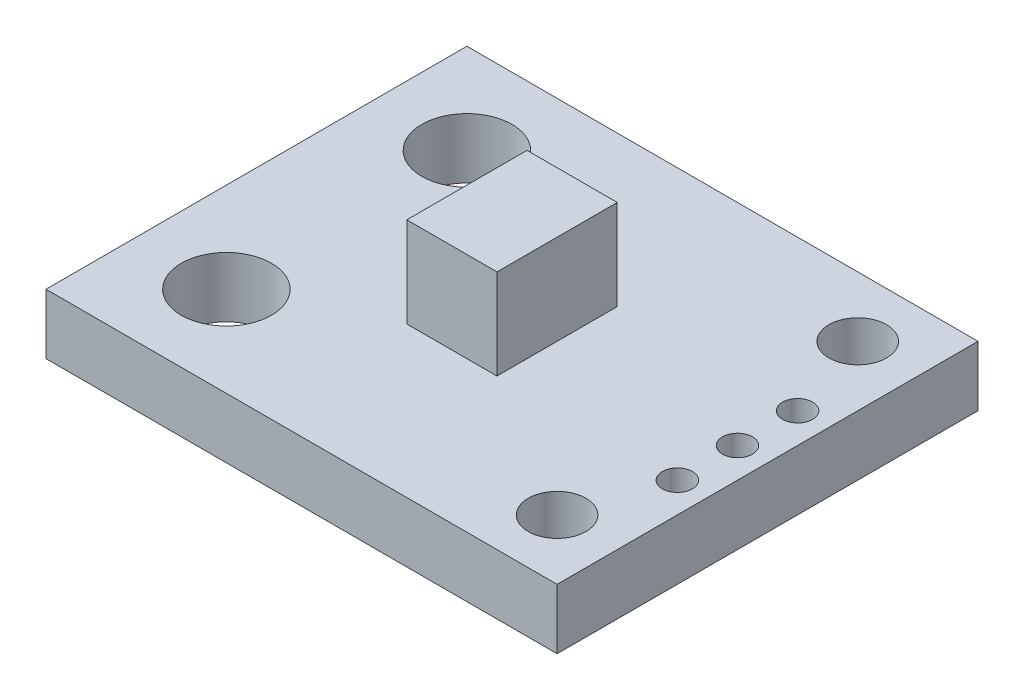
from build123d import *

# Parameters (mm, degrees)
SKETCH1_W                 = 21.59
SKETCH1_H                 = 17.78
BOSS_EXTRUDE1_DEPTH       = 2.54
SKETCH2_R                 = 1.905
SKETCH2_R_2               = 0.635
CUT_EXTRUDE1_DEPTH        = 15.213223596
SKETCH3_W                 = 3.81
SKETCH3_H                 = 5.08
BOSS_EXTRUDE2_DEPTH       = 3.81
F_2_CLEARANCE_HOLE1_D     = 2.4384
F_2_CLEARANCE_HOLE1_DEPTH = 6.35
F_2_CLEARANCE_HOLE1_TIP   = 0.732569267


with BuildPart() as part:
    # Sketch1 → Boss-Extrude1 (new body)
    with BuildSketch(Plane(origin=(0, 0, 0), x_dir=(1, 0, 0), z_dir=(0, 1, 0))):
        Rectangle(SKETCH1_W, SKETCH1_H)
    extrude(amount=BOSS_EXTRUDE1_DEPTH)

    # Sketch2 → Cut-Extrude1 (cut, through all)
    with BuildSketch(Plane(origin=(0, 2.54, 0), x_dir=(1, 0, 0), z_dir=(0, 1, 0))):
        with Locations(Location((-6.985, 5.08, 0), (0, 0, 270))):
            Circle(SKETCH2_R)
        with Locations(Location((-6.985, -5.08, 0), (0, 0, 270))):
            Circle(SKETCH2_R)
        with Locations(Location((9.525, 2.54, 0), (0, 0, 270))):
            Circle(SKETCH2_R_2)
        with Locations(Location((9.525, 0, 0), (0, 0, 270))):
            Circle(SKETCH2_R_2)
        with Locations(Location((9.525, -2.54, 0), (0, 0, 270))):
            Circle(SKETCH2_R_2)
    extrude(amount=-CUT_EXTRUDE1_DEPTH, mode=Mode.SUBTRACT)

    # Sketch3 → Boss-Extrude2 (add)
    with BuildSketch(Plane(origin=(0, 2.54, 0), x_dir=(1, 0, 0), z_dir=(0, 1, 0))):
        Rectangle(SKETCH3_W, SKETCH3_H)
    extrude(amount=BOSS_EXTRUDE2_DEPTH)

    # #2 Clearance Hole1
    with Locations(Plane(origin=(0, 2.54, 0), x_dir=(1, 0, 0), z_dir=(0, 1, 0))):
        with Locations((8.255, 6.35), (8.255, -6.35)):
            Hole(F_2_CLEARANCE_HOLE1_D / 2, depth=F_2_CLEARANCE_HOLE1_DEPTH)
            with Locations((0, 0, -(F_2_CLEARANCE_HOLE1_DEPTH + F_2_CLEARANCE_HOLE1_TIP / 2))):  # 118° drill point
                Cone(0, F_2_CLEARANCE_HOLE1_D / 2, F_2_CLEARANCE_HOLE1_TIP, mode=Mode.SUBTRACT)


solid = part.part
